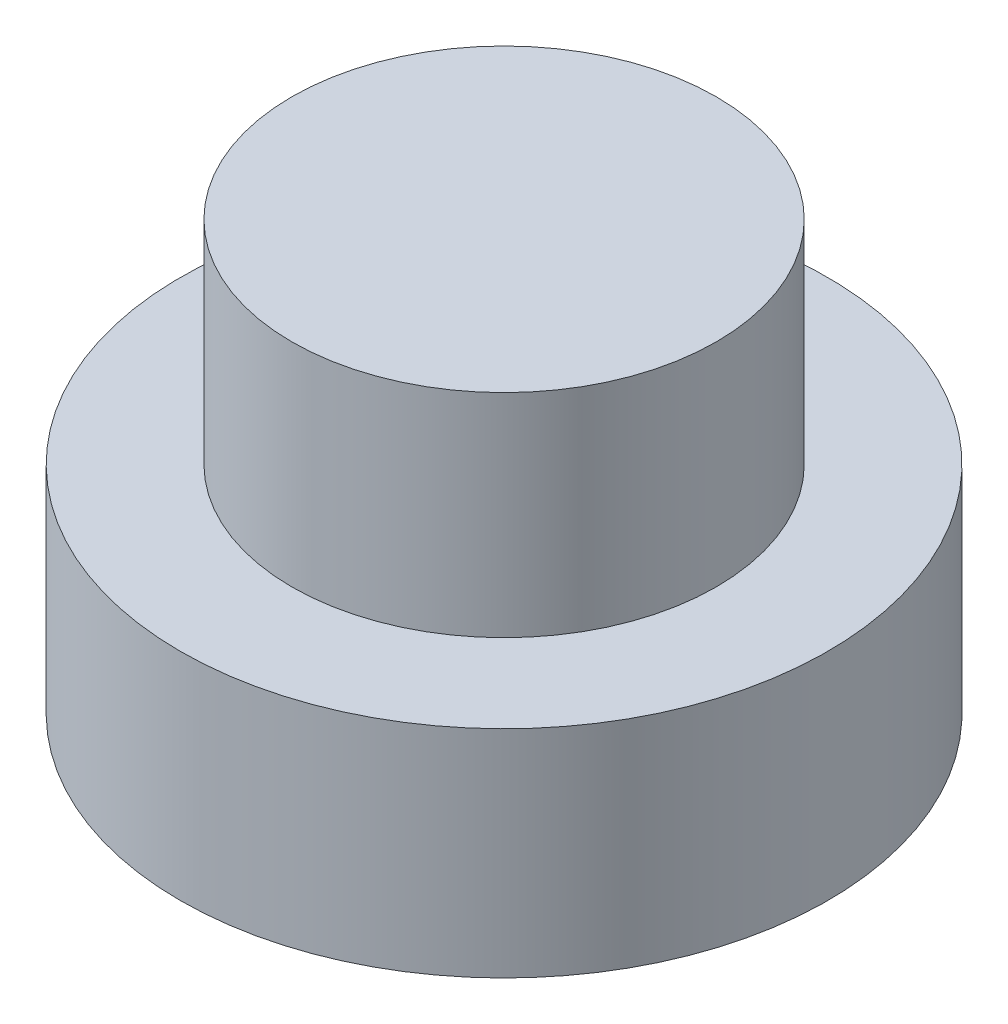
from build123d import *

# Parameters (mm, degrees)
SKETCH1_R           = 9
BOSS_EXTRUDE1_DEPTH = 6
SKETCH2_R           = 5.9
BOSS_EXTRUDE2_DEPTH = 20
SKETCH5_R           = 9.837832021
CUT_EXTRUDE3_DEPTH  = 14.1


with BuildPart() as part:
    # Sketch1 → Boss-Extrude1 (new body)
    with BuildSketch(Plane(origin=(0, 0, 0), x_dir=(1, 0, 0), z_dir=(0, 1, 0))):
        with Locations(Location((0, 0, 0), (0, 0, 270))):
            Circle(SKETCH1_R)
    extrude(amount=BOSS_EXTRUDE1_DEPTH)

    # Sketch2 → Boss-Extrude2 (add)
    with BuildSketch(Plane(origin=(0, 6, 0), x_dir=(1, 0, 0), z_dir=(0, 1, 0))):
        with Locations(Location((0, 0, 0), (0, 0, 270))):
            Circle(SKETCH2_R)
    extrude(amount=BOSS_EXTRUDE2_DEPTH)

    # Sketch5 → Cut-Extrude3 (cut)
    with BuildSketch(Plane(origin=(0, 26, 0), x_dir=(1, 0, 0), z_dir=(0, 1, 0))):
        Circle(SKETCH5_R)
    extrude(amount=-CUT_EXTRUDE3_DEPTH, mode=Mode.SUBTRACT)


solid = part.part
